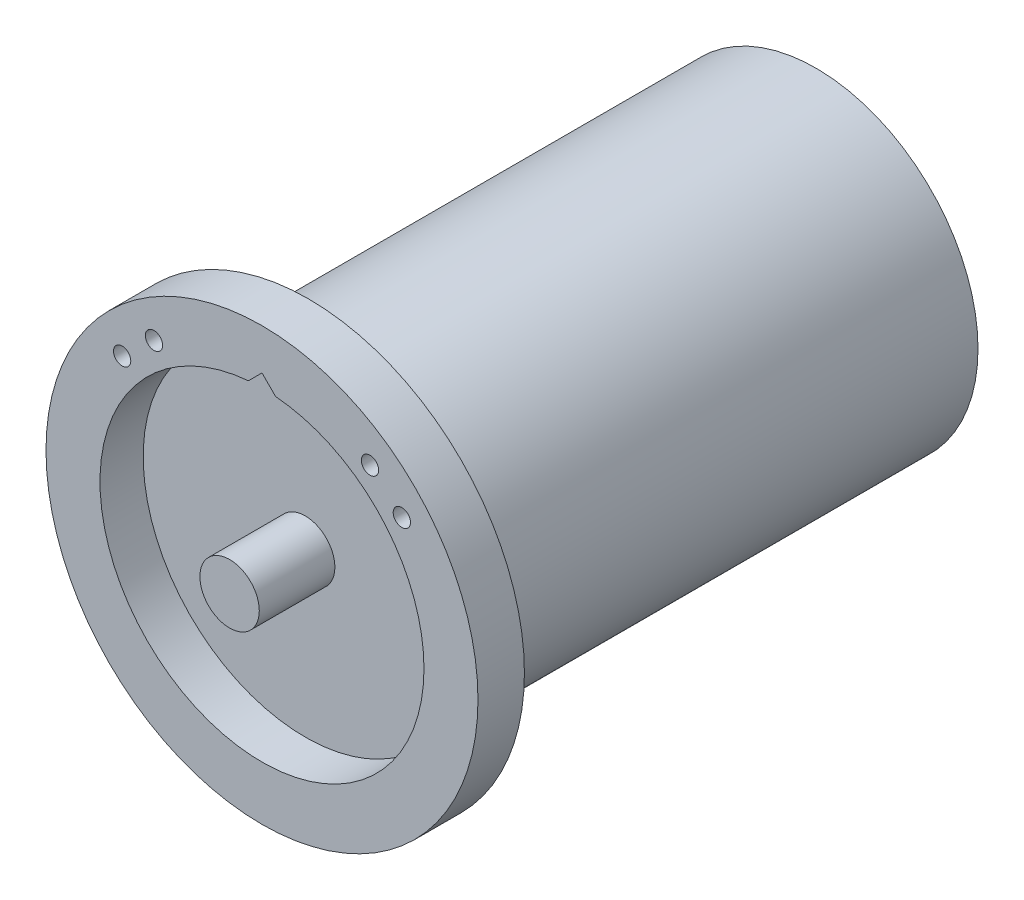
from build123d import *

# Parameters (mm, degrees)
SKETCH_2_R          = 15.5
EXTRUDE_1_DEPTH     = 2
SKETCH_3_R          = 15
EXTRUDE_2_DEPTH     = 45
SKETCH_4_R          = 20
EXTRUDE_3_DEPTH     = 4.3
SKETCH_5_R          = 15
CUT_EXTRUDE_2_DEPTH = 4
SKETCH_6_R          = 2.75
EXTRUDE_4_DEPTH     = 7
SKETCH_7_R          = 0.8
CUT_EXTRUDE_3_DEPTH = 7
CUT_EXTRUDE_4_DEPTH = 2
SKETCH_10_R         = 1.6
CUT_EXTRUDE_5_DEPTH = 10


with BuildPart() as part:
    # 草图2 → 凸台-拉伸1 (new body)
    with BuildSketch(Plane.XY):
        Circle(SKETCH_2_R)
    extrude(amount=EXTRUDE_1_DEPTH)

    # 草图3 → 凸台-拉伸2 (add)
    with BuildSketch(Plane(origin=(0, 0, 0), x_dir=(-1, 0, 0), z_dir=(0, 0, -1))):
        with Locations(Location((0, 0, 0), (0, 0, 180))):
            Circle(SKETCH_3_R)
    extrude(amount=EXTRUDE_2_DEPTH)

    # 草图4 → 凸台-拉伸3 (add)
    with BuildSketch(Plane.XY.offset(2)):
        with Locations(Location((0, 0, 0), (0, 0, 180))):
            Circle(SKETCH_4_R)
    extrude(amount=EXTRUDE_3_DEPTH)

    # 草图5 → 切除-拉伸2 (cut)
    with BuildSketch(Plane.XY.offset(6.3)):
        Circle(SKETCH_5_R)
    extrude(amount=-CUT_EXTRUDE_2_DEPTH, mode=Mode.SUBTRACT)

    # 草图6 → 凸台-拉伸4 (add)
    with BuildSketch(Plane.XY.offset(2.3)):
        Circle(SKETCH_6_R)
    extrude(amount=EXTRUDE_4_DEPTH)

    # 草图7 → 切除-拉伸3 (cut)
    with BuildSketch(Plane.XY.offset(6.3)):
        with Locations((-10, 13.809507594)):
            Circle(SKETCH_7_R)
        with Locations((10, 13.809507594)):
            Circle(SKETCH_7_R)
        with Locations((-12.95, 11.090536506)):
            Circle(SKETCH_7_R)
        with Locations((12.95, 11.090536506)):
            Circle(SKETCH_7_R)
    extrude(amount=-CUT_EXTRUDE_3_DEPTH, mode=Mode.SUBTRACT)

    # 草图9 → 切除-拉伸4 (cut)
    with BuildSketch(Plane.XY.offset(6.3)):
        Polygon((-2.828427125, 13.378), (0, 16.206427125), (2.828427125, 13.378), (0, 10.549572875), align=None)
    extrude(amount=-CUT_EXTRUDE_4_DEPTH, mode=Mode.SUBTRACT)

    # 草图10 → 切除-拉伸5 (cut)
    with BuildSketch(Plane(origin=(0, 0, -45), x_dir=(-1, 0, 0), z_dir=(0, 0, -1))):
        with Locations((11.258330249, 6.5)):
            Circle(SKETCH_10_R)
        with Locations((0, 13)):
            Circle(SKETCH_10_R)
        with Locations((11.258330249, -6.5)):
            Circle(SKETCH_10_R)
        with Locations((0, -13)):
            Circle(SKETCH_10_R)
        with Locations((-11.258330249, -6.5)):
            Circle(SKETCH_10_R)
        with Locations((-11.258330249, 6.5)):
            Circle(SKETCH_10_R)
    extrude(amount=-CUT_EXTRUDE_5_DEPTH, mode=Mode.SUBTRACT)


solid = part.part
